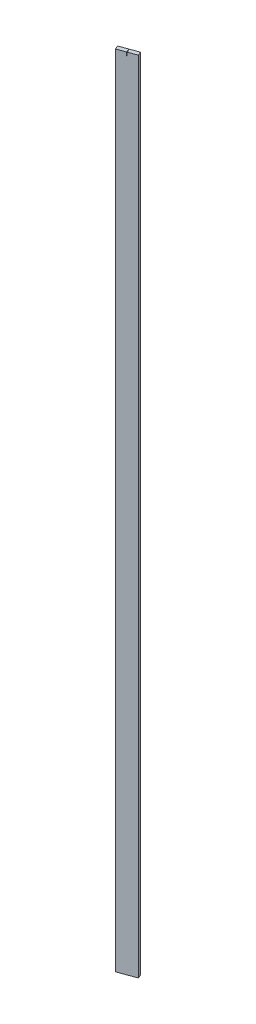
from build123d import *

# Parameters (mm, degrees)
SKETCH_1_W          = 44.8
SKETCH_1_H          = 2000
EXTRUDE_1_DEPTH     = 10
CUT_EXTRUDE_2_DEPTH = 3329.04869605
EXTRUDE_2_DEPTH     = 44.8
CUT_EXTRUDE_3_DEPTH = 8.96


with BuildPart() as part:
    # 草图1 → 凸台-拉伸1 (new body)
    with BuildSketch(Plane(origin=(915.505475204, 0, 2515.33062051), x_dir=(-0.9396926207859093, 0, 0.3420201433256663), z_dir=(-0.3420201433256663, 0, -0.9396926207859093))):
        with Locations((-82.338659964, -943.731460395)):
            Rectangle(SKETCH_1_W, SKETCH_1_H)
    extrude(amount=-EXTRUDE_1_DEPTH)

    # 草图2 → 切除-拉伸2 (cut, through all)
    with BuildSketch(Plane(origin=(56.323916468, 0, -20.500229072), x_dir=(0.34202014332566644, 0, 0.9396926207859093), z_dir=(-0.9396926207859092, 0, 0.3420201433256664))):
        with BuildLine():
            Line((2678.733687242, 56.268539605), (2678.733687242, 49.653408924))
            Line((2678.733687242, 49.653408924), (2684.784186307, 49.653408924))
            ThreePointArc((2684.784186307, 49.653408924), (2684.783800485, 49.701723134), (2684.78264312, 49.750025021))
            Line((2684.78264312, 49.750025021), (2684.784186307, 56.268539605))
            Line((2684.784186307, 56.268539605), (2678.733687242, 56.268539605))
        make_face()
        with BuildLine():
            Line((2684.784186307, 49.653408924), (2678.733687242, 49.653408924))
            ThreePointArc((2678.733687242, 49.653408924), (2681.758936775, 46.628159392), (2684.784186307, 49.653408924))
        make_face()
    extrude(amount=-CUT_EXTRUDE_2_DEPTH, mode=Mode.SUBTRACT)

    # 草图3 → 凸台-拉伸2 (add)
    with BuildSketch(Plane(origin=(56.323916468, 0, -20.500229072), x_dir=(0.34202014332566644, 0, 0.9396926207859093), z_dir=(-0.9396926207859092, 0, 0.3420201433256664))):
        with BuildLine():
            Line((2678.733687242, 49.653408924), (2678.733687242, 56.268539605))
            Line((2678.733687242, 56.268539605), (2684.784186307, 56.268539605))
            Line((2684.784186307, 56.268539605), (2684.784186307, 49.653408924))
            ThreePointArc((2684.784186307, 49.653408924), (2681.758936775, 46.628159392), (2678.733687242, 49.653408924))
        make_face()
    extrude(amount=-EXTRUDE_2_DEPTH)

    # 草图4 → 切除-拉伸3 (cut)
    with BuildSketch(Plane(origin=(0, 56.268539605, 0), x_dir=(1, 0, 0), z_dir=(0, 1, 0))):
        Polygon((995.8288615, -2496.737076507), (996.29870781, -2496.566066436), (992.878506377, -2487.169140228), (992.408660067, -2487.340150299), align=None)
        Polygon((992.878506377, -2487.169140228), (996.29870781, -2496.566066436), (996.768554121, -2496.395056364), (993.348352687, -2486.998130156), align=None)
    extrude(amount=-CUT_EXTRUDE_3_DEPTH, mode=Mode.SUBTRACT)


solid = part.part
